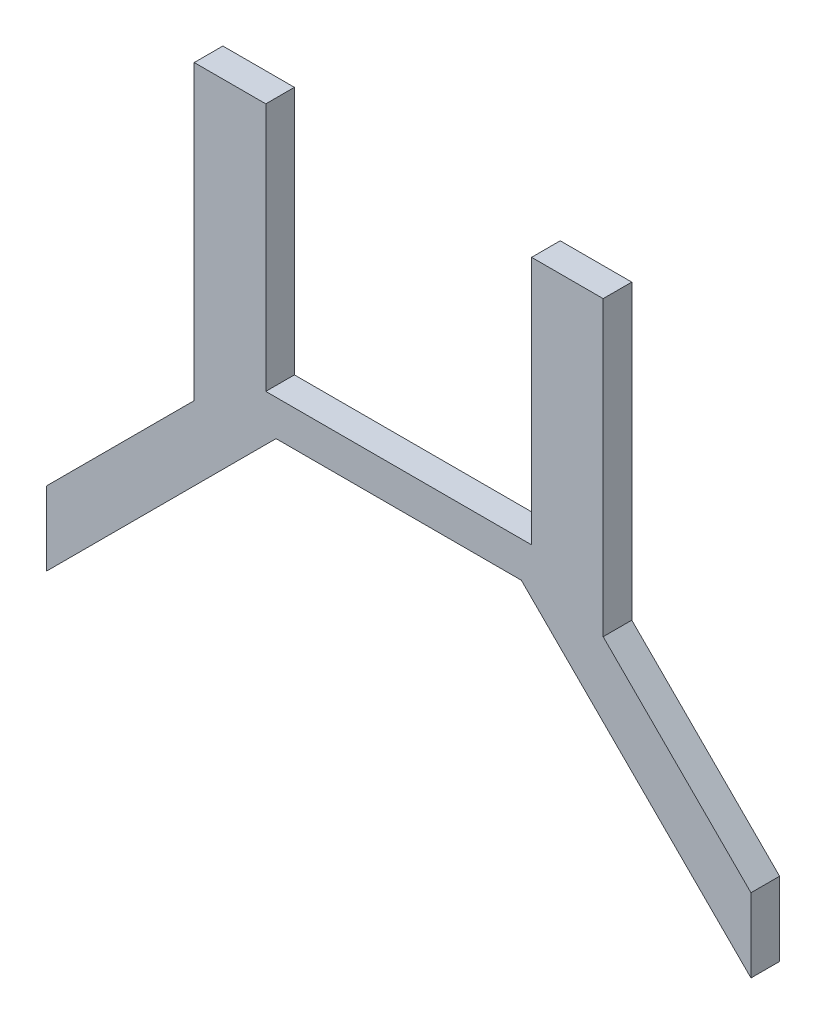
from build123d import *

# Parameters (mm, degrees)
BOSS_EXTRU_1_DEPTH = 8


with BuildPart() as part:
    # Esquisse1 → Boss.-Extru.1 (new body)
    with BuildSketch(Plane(origin=(0, 0, 0), x_dir=(-1, 0, 0), z_dir=(0, 0, -1))):
        Polygon((43.918221478, 28.008066704), (2.599421562, -13.310733211), (2.599421562, -33.949941515), (66.786548928, 30.237185851), (135.349894027, 30.237185851), (199.537021393, -33.949941515), (199.537021393, -13.310733211), (158.218221478, 28.008066704), (158.218221478, 109.848159974), (138.218221478, 109.848159974), (138.218221478, 40.237185851), (63.918221478, 40.237185851), (63.918221478, 109.848159974), (43.918221478, 109.848159974), align=None)
    extrude(amount=-BOSS_EXTRU_1_DEPTH)


solid = part.part
